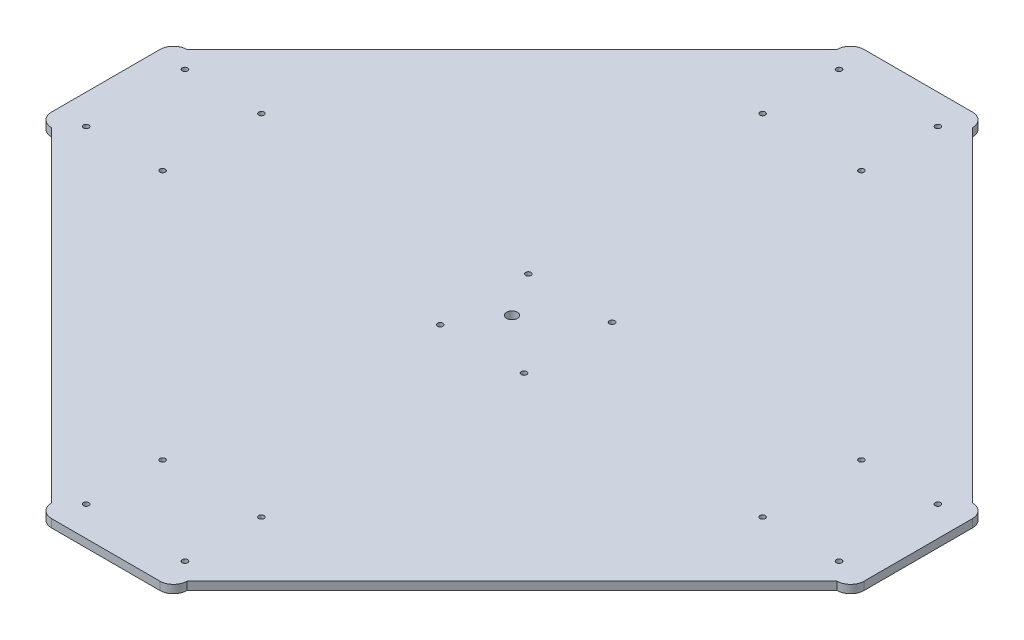
from build123d import *

# Parameters (mm, degrees)
BOSS_EXTRUDE1_DEPTH       = 6
SKETCH4_R                 = 0.495653738
CUT_EXTRUDE3_DEPTH        = 10
BOSS_EXTRUDE3_DEPTH       = 6
SKETCH6_R                 = 2
SKETCH6_R_2               = 4
CUT_EXTRUDE4_DEPTH        = 12
CIRPATTERN1_COUNT         = 4
BOSS_EXTRUDE4_DEPTH       = 6
F_4_0MM_DOWEL_HOLE4_D     = 4
F_4_0MM_DOWEL_HOLE4_DEPTH = 98.31
F_4_0MM_DOWEL_HOLE4_TIP   = 1.201721238
F_4_0MM_DOWEL_HOLE5_D     = 4
F_4_0MM_DOWEL_HOLE5_DEPTH = 98.31
F_4_0MM_DOWEL_HOLE5_TIP   = 1.201721238
SKETCH34_W                = 35.409448417
SKETCH34_H                = 30.185103568
SKETCH34_W_2              = 36.570413939
SKETCH34_H_2              = 111.452690099
SKETCH34_W_3              = 29.604620807
SKETCH34_H_3              = 33.087517373
SKETCH34_W_4              = 33.087517373
SKETCH34_W_5              = 27.282689764
SKETCH34_H_4              = 24.96075872
SKETCH34_W_6              = 20.316896633
SKETCH34_H_5              = 92.296758988
SKETCH34_W_7              = 27.863172524
SKETCH34_H_6              = 11.609655218
SKETCH34_W_8              = 24.025079094
SKETCH34_H_7              = 13.26196209
SKETCH34_W_9              = 25.256962543
SKETCH34_H_8              = 14.571324544
SKETCH34_W_10             = 26.74183209
SKETCH34_H_9              = 13.599902908
SKETCH34_W_11             = 6.832653797
SKETCH34_H_10             = 26.571431431
SKETCH34_W_12             = 13.665307593
SKETCH34_H_11             = 29.608166452
SKETCH34_W_13             = 111.542887187
SKETCH34_H_12             = 48.356959239
SKETCH34_W_14             = 14.599955316
SKETCH34_H_13             = 35.285066425
SKETCH34_W_15             = 19.210467522
SKETCH34_H_14             = 26.471341651
SKETCH34_W_16             = 101.584483163
SKETCH34_H_15             = 31.891508091
SKETCH34_W_17             = 12.108434582
SKETCH34_H_16             = 29.018914361
SKETCH34_W_18             = 8.981277634
SKETCH34_H_17             = 24.21737362
SKETCH34_W_19             = 29.087219519
SKETCH34_H_18             = 16.362951604
SKETCH34_W_20             = 17.661842556
SKETCH34_H_19             = 22.206862892
SKETCH34_W_21             = 25.871946372
SKETCH34_W_22             = 23.792293824
SKETCH34_H_20             = 9.539966182
SKETCH34_H_21             = 15.633594749
SKETCH34_W_23             = 12.316273022
SKETCH34_H_22             = 19.237958234
BOSS_EXTRUDE5_DEPTH       = 6


with BuildPart() as part:
    # Sketch1 → Boss-Extrude1 (new body)
    with BuildSketch(Plane(origin=(0, 0, 0), x_dir=(1, 0, 0), z_dir=(0, 1, 0))):
        with BuildLine():
            Line((-110, 50), (-300, 50))
            ThreePointArc((-300, 50), (-307.071067812, 47.071067812), (-310, 40))
            Line((-310, 40), (-310, -40))
            ThreePointArc((-310, -40), (-307.071067812, -47.071067812), (-300, -50))
            Line((-300, -50), (-110, -50))
            Line((-110, -50), (-60, -100))
            Line((-60, -100), (-60, -290))
            ThreePointArc((-60, -290), (-57.071067812, -297.071067812), (-50, -300))
            Line((-50, -300), (30, -300))
            ThreePointArc((30, -300), (37.071067812, -297.071067812), (40, -290))
            Line((40, -290), (40, -100))
            Line((40, -100), (90, -50))
            Line((90, -50), (280, -50))
            ThreePointArc((280, -50), (287.071067812, -47.071067812), (290, -40))
            Line((290, -40), (290, 40))
            ThreePointArc((290, 40), (287.071067812, 47.071067812), (280, 50))
            Line((280, 50), (90, 50))
            Line((90, 50), (40, 100))
            Line((40, 100), (40, 290))
            ThreePointArc((40, 290), (37.071067812, 297.071067812), (30, 300))
            Line((30, 300), (-50, 300))
            ThreePointArc((-50, 300), (-57.071067812, 297.071067812), (-60, 290))
            Line((-60, 290), (-60, 100))
            Line((-60, 100), (-110, 50))
        make_face()
    extrude(amount=BOSS_EXTRUDE1_DEPTH)

    # Sketch4 → Cut-Extrude3 (cut)
    with BuildSketch(Plane(origin=(0, 6, 0), x_dir=(1, 0, 0), z_dir=(0, 1, 0))):
        with Locations(Location((-10, 0, 0), (0, 0, 270))):
            Circle(SKETCH4_R)
    extrude(amount=-CUT_EXTRUDE3_DEPTH, mode=Mode.SUBTRACT)

    # Sketch5 → Boss-Extrude3 (add)
    with BuildSketch(Plane(origin=(0, 6, 0), x_dir=(1, 0, 0), z_dir=(0, 1, 0))):
        Polygon((-300, 50), (-60, 290), (-60, 240), (-250, 50), align=None)
        Polygon((40, 290), (280, 50), (230, 50), (40, 240), align=None)
        Polygon((280, -50), (40, -290), (40, -240), (230, -49.07797178), align=None)
        Polygon((-300, -50), (-60, -290), (-60, -240), (-250, -50), align=None)
    extrude(amount=-BOSS_EXTRUDE3_DEPTH)

    # Sketch6 → Cut-Extrude4 (cut)
    with BuildSketch(Plane(origin=(0, 6, 0), x_dir=(1, 0, 0), z_dir=(0, 1, 0))):
        with Locations(Location((-37.824146891, 287.83697558, 0), (0, 0, 270))):
            Circle(SKETCH6_R)
        with Locations(Location((-37.824146891, 272.83697558, 0), (0, 0, 270))):
            Circle(SKETCH6_R)
        with Locations(Location((-46.483109463, 221.536893944, 0), (0, 0, 270))):
            Circle(SKETCH6_R)
        with Locations(Location((-46.483109463, 135.06793836, 0), (0, 0, 270))):
            Circle(SKETCH6_R)
        with Locations(Location((-69.817594081, 73.334484618, 0), (0, 0, 270))):
            Circle(SKETCH6_R)
        with Locations(Location((49.817594081, 73.334484618, 0), (0, 0, 270))):
            Circle(SKETCH6_R)
        with Locations(Location((26.483109463, 135.06793836, 0), (0, 0, 270))):
            Circle(SKETCH6_R)
        with Locations(Location((26.483109463, 221.536893944, 0), (0, 0, 270))):
            Circle(SKETCH6_R)
        with Locations(Location((191.360389693, 113.639610307, 0), (0, 0, 270))):
            Circle(SKETCH6_R)
        with Locations(Location((128.639610307, 176.360389693, 0), (0, 0, 270))):
            Circle(SKETCH6_R)
        with Locations(Location((17.824146891, 272.83697558, 0), (0, 0, 270))):
            Circle(SKETCH6_R)
        with Locations(Location((17.824146891, 287.83697558, 0), (0, 0, 270))):
            Circle(SKETCH6_R)
        with Locations(Location((-10, 0, 0), (0, 0, 270))):
            Circle(SKETCH6_R_2)
    cut_extrude4 = extrude(amount=-CUT_EXTRUDE4_DEPTH, mode=Mode.SUBTRACT)

    # CirPattern1: Cut-Extrude4 ×4 about axis
    cirpattern1_axis = Axis((-10, 0, 0), (0, 1, 0))
    for i in range(1, CIRPATTERN1_COUNT):
        add(cut_extrude4.rotate(cirpattern1_axis, i * 360 / CIRPATTERN1_COUNT), mode=Mode.SUBTRACT)

    # Sketch7 → Boss-Extrude4 (add)
    with BuildSketch(Plane(origin=(0, 6, 0), x_dir=(1, 0, 0), z_dir=(0, 1, 0))):
        Polygon((40, 240), (230, 50), (90, 50), (40, 100), align=None)
        Polygon((90, -50), (229.082424571, -50), (40, -240), (40, -100), align=None)
        Polygon((-60, 240), (-60, 100), (-110, 50), (-250, 50), align=None)
        Polygon((-110, -50), (-60, -100), (-60, -240), (-250, -50), align=None)
    extrude(amount=-BOSS_EXTRUDE4_DEPTH)

    # Ø4.0mm Dowel Hole4
    with Locations(Plane(origin=(0, 0, 0), x_dir=(-1, 0, 0), z_dir=(0, -1, 0))):
        with Locations((46.483109463, -278), (-26.483109463, -278), (-268, -36.483109463), (-268, 36.483109463), (-26.483109463, 278), (46.483109463, 278), (288, 36.483109463), (288, -36.483109463)):
            Hole(F_4_0MM_DOWEL_HOLE4_D / 2, depth=F_4_0MM_DOWEL_HOLE4_DEPTH)
            with Locations((0, 0, -(F_4_0MM_DOWEL_HOLE4_DEPTH + F_4_0MM_DOWEL_HOLE4_TIP / 2))):  # 118° drill point
                Cone(0, F_4_0MM_DOWEL_HOLE4_D / 2, F_4_0MM_DOWEL_HOLE4_TIP, mode=Mode.SUBTRACT)

    # Ø4.0mm Dowel Hole5
    with Locations(Plane(origin=(0, 6, 0), x_dir=(1, 0, 0), z_dir=(0, 1, 0))):
        with Locations((-30.430566073, -32.5), (31.383083735, -32.5), (31.383083735, 32.5), (-30.430566073, 32.5)):
            Hole(F_4_0MM_DOWEL_HOLE5_D / 2, depth=F_4_0MM_DOWEL_HOLE5_DEPTH)
            with Locations((0, 0, -(F_4_0MM_DOWEL_HOLE5_DEPTH + F_4_0MM_DOWEL_HOLE5_TIP / 2))):  # 118° drill point
                Cone(0, F_4_0MM_DOWEL_HOLE5_D / 2, F_4_0MM_DOWEL_HOLE5_TIP, mode=Mode.SUBTRACT)

    # Sketch34 → Boss-Extrude5 (add)
    with BuildSketch(Plane(origin=(0, 6, 0), x_dir=(1, 0, 0), z_dir=(0, 1, 0))):
        with Locations((-78.80313436, 68.745934319)):
            Rectangle(SKETCH34_W, SKETCH34_H)
        with Locations((-144.397686345, -2.072962514)):
            Rectangle(SKETCH34_W_2, SKETCH34_H_2)
        with Locations((-75.900720554, -65.635824837)):
            Rectangle(SKETCH34_W_3, SKETCH34_H_3)
        with Locations((57.029831699, -65.635824837)):
            Rectangle(SKETCH34_W_4, SKETCH34_H_3)
        with Locations((59.932245503, 66.133761895)):
            Rectangle(SKETCH34_W_5, SKETCH34_H_4)
        with Locations((127.268245772, 1.700175431)):
            Rectangle(SKETCH34_W_6, SKETCH34_H_5)
        with Locations((-288.647652436, 25.79021001)):
            Rectangle(SKETCH34_W_7, SKETCH34_H_6)
        with Locations((-290.566699151, -25.743228086)):
            Rectangle(SKETCH34_W_8, SKETCH34_H_7)
        with Locations((-207.82626231, -113.697936261)):
            Rectangle(SKETCH34_W_9, SKETCH34_H_8)
        with Locations((-149.311977269, -174.411788529)):
            Rectangle(SKETCH34_W_10, SKETCH34_H_9)
        with Locations((-37.704576229, -280.142299522)):
            Rectangle(SKETCH34_W_11, SKETCH34_H_10)
        with Locations((16.577062267, -278.623932011)):
            Rectangle(SKETCH34_W_12, SKETCH34_H_11)
        with Locations((-15.285370581, -137.876415881)):
            Rectangle(SKETCH34_W_13, SKETCH34_H_12)
        with Locations((102.99002157, -192.054321742)):
            Rectangle(SKETCH34_W_14, SKETCH34_H_13)
        with Locations((162.158261537, -134.219269359)):
            Rectangle(SKETCH34_W_15, SKETCH34_H_14)
        with Locations((-10.306168569, 138.617659885)):
            Rectangle(SKETCH34_W_16, SKETCH34_H_15)
        with Locations((-35.066685836, 277.003869093)):
            Rectangle(SKETCH34_W_17, SKETCH34_H_16)
        with Locations((17.598670848, 280.473392986)):
            Rectangle(SKETCH34_W_18, SKETCH34_H_17)
        with Locations((-180.654171279, 134.499996933)):
            Rectangle(SKETCH34_W_19, SKETCH34_H_18)
        with Locations((-117.281558097, 197.029847706)):
            Rectangle(SKETCH34_W_20, SKETCH34_H_19)
        with Locations((271.071548242, 25.79021001)):
            Rectangle(SKETCH34_W_21, SKETCH34_H_6)
        with Locations((270.031721968, -27.60422604)):
            Rectangle(SKETCH34_W_22, SKETCH34_H_20)
        with Locations((127.268245772, 172.147264617)):
            Rectangle(SKETCH34_W_6, SKETCH34_H_21)
        with Locations((187.981166364, 113.052926722)):
            Rectangle(SKETCH34_W_23, SKETCH34_H_22)
    extrude(amount=-BOSS_EXTRUDE5_DEPTH)


solid = part.part
